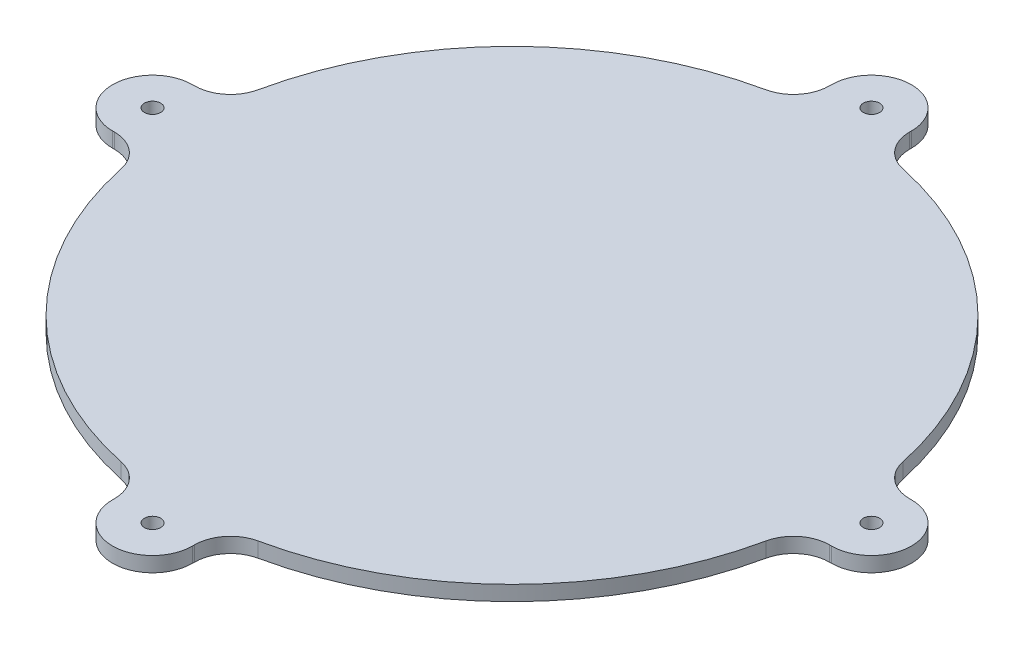
from build123d import *

# Parameters (mm, degrees)
SKETCH1_R           = 1.7272
BOSS_EXTRUDE1_DEPTH = 3.175
FILLET2_R           = 7.62


with BuildPart() as part:
    # Sketch1 → Boss-Extrude1 (new body)
    with BuildSketch(Plane(origin=(0, 0, 0), x_dir=(1, 0, 0), z_dir=(0, 1, 0))):
        with BuildLine():
            Line((-8.4836, 76.2), (-8.4836, 69.332900062))
            ThreePointArc((-8.4836, 69.332900062), (-49.391408666, 49.391408666), (-69.332900062, 8.4836))
            Line((-69.332900062, 8.4836), (-76.2, 8.4836))
            ThreePointArc((-76.2, 8.4836), (-84.6836, 0), (-76.2, -8.4836))
            Line((-76.2, -8.4836), (-69.332900062, -8.4836))
            ThreePointArc((-69.332900062, -8.4836), (-49.391408666, -49.391408666), (-8.4836, -69.332900062))
            Line((-8.4836, -69.332900062), (-8.4836, -76.2))
            ThreePointArc((-8.4836, -76.2), (0, -84.6836), (8.4836, -76.2))
            Line((8.4836, -76.2), (8.4836, -69.332900062))
            ThreePointArc((8.4836, -69.332900062), (49.391408666, -49.391408666), (69.332900062, -8.4836))
            Line((69.332900062, -8.4836), (76.2, -8.4836))
            ThreePointArc((76.2, -8.4836), (84.6836, 0), (76.2, 8.4836))
            Line((76.2, 8.4836), (69.332900062, 8.4836))
            ThreePointArc((69.332900062, 8.4836), (49.391408666, 49.391408666), (8.4836, 69.332900062))
            Line((8.4836, 69.332900062), (8.4836, 76.2))
            ThreePointArc((8.4836, 76.2), (0, 84.6836), (-8.4836, 76.2))
        make_face()
        with Locations(Location((0, 76.2, 0), (0, 0, 270))):
            Circle(SKETCH1_R, mode=Mode.SUBTRACT)
        with Locations(Location((76.2, 0, 0), (0, 0, 270))):
            Circle(SKETCH1_R, mode=Mode.SUBTRACT)
        with Locations(Location((0, -76.2, 0), (0, 0, 270))):
            Circle(SKETCH1_R, mode=Mode.SUBTRACT)
        with Locations(Location((-76.2, 0, 0), (0, 0, 270))):
            Circle(SKETCH1_R, mode=Mode.SUBTRACT)
    extrude(amount=BOSS_EXTRUDE1_DEPTH)

    # Fillet2
    fillet2_edges = [part.edges().sort_by_distance(p)[0] for p in [
        (8.4836, 1.5875, -69.332900062),
        (69.332900062, 1.5875, -8.4836),
        (69.332900062, 1.5875, 8.4836),
        (8.4836, 1.5875, 69.332900062),
        (-8.4836, 1.5875, 69.332900062),
        (-69.332900062, 1.5875, 8.4836),
        (-69.332900062, 1.5875, -8.4836),
        (-8.4836, 1.5875, -69.332900062),
    ]]
    fillet(fillet2_edges, radius=FILLET2_R)


solid = part.part
